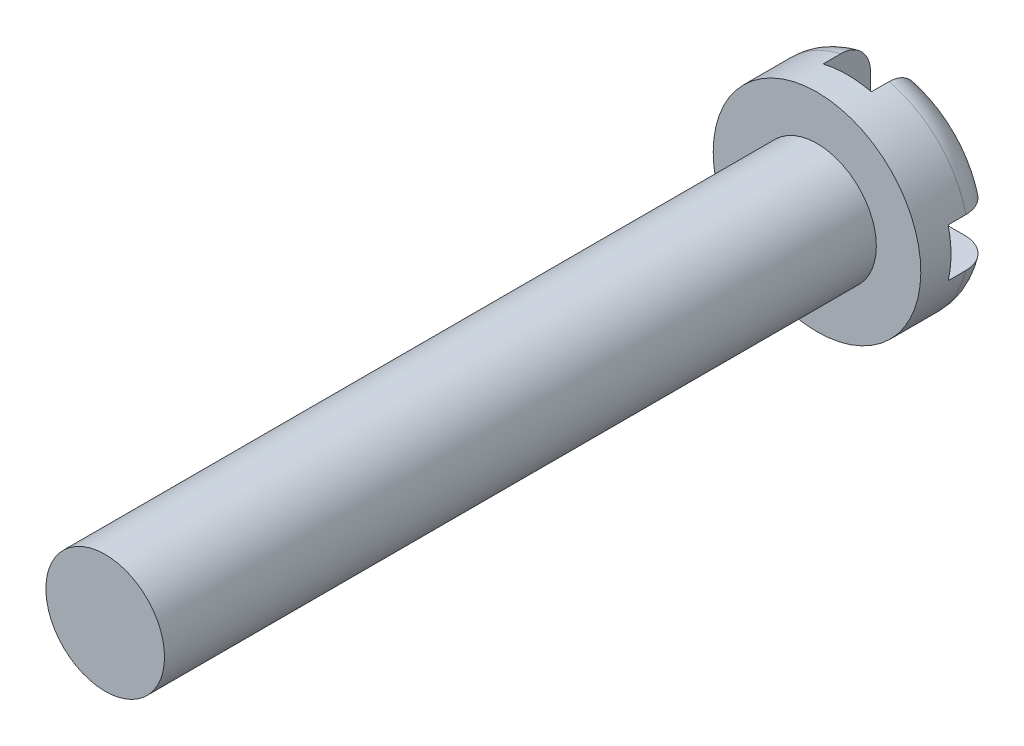
from build123d import *

# Parameters (mm, degrees)
SKETCH_1_R          = 1
EXTRUDE_1_DEPTH     = 12
SKETCH_2_R          = 1.75
EXTRUDE_2_DEPTH     = 1.31
FILLET_1_R          = 0.5
CUT_EXTRUDE_1_DEPTH = 0.8


with BuildPart() as part:
    # 草图1 → 凸台-拉伸1 (new body)
    with BuildSketch(Plane.XY):
        Circle(SKETCH_1_R)
    extrude(amount=EXTRUDE_1_DEPTH)

    # 草图2 → 凸台-拉伸2 (add)
    with BuildSketch(Plane(origin=(0, 0, 0), x_dir=(-1, 0, 0), z_dir=(0, 0, -1))):
        Circle(SKETCH_2_R)
    extrude(amount=EXTRUDE_2_DEPTH)

    # 圆角1
    fillet_1_edges = [part.edges().sort_by_distance(p)[0] for p in [
        (1.75, 0, -1.31),
    ]]
    fillet(fillet_1_edges, radius=FILLET_1_R)

    # 草图3 → 切除-拉伸1 (cut)
    with BuildSketch(Plane(origin=(0, 0, -1.31), x_dir=(-1, 0, 0), z_dir=(0, 0, -1))):
        Polygon((0.407106781, 0.407106781), (0.407106781, 5.706401657), (-0.407106781, 5.706401657), (-0.407106781, 0.407106781), (-5.706401657, 0.407106781), (-5.706401657, -0.407106781), (-0.407106781, -0.407106781), (-0.407106781, -5.706401657), (0.407106781, -5.706401657), (0.407106781, -0.407106781), (5.706401657, -0.407106781), (5.706401657, 0.407106781), align=None)
    extrude(amount=-CUT_EXTRUDE_1_DEPTH, mode=Mode.SUBTRACT)


solid = part.part
